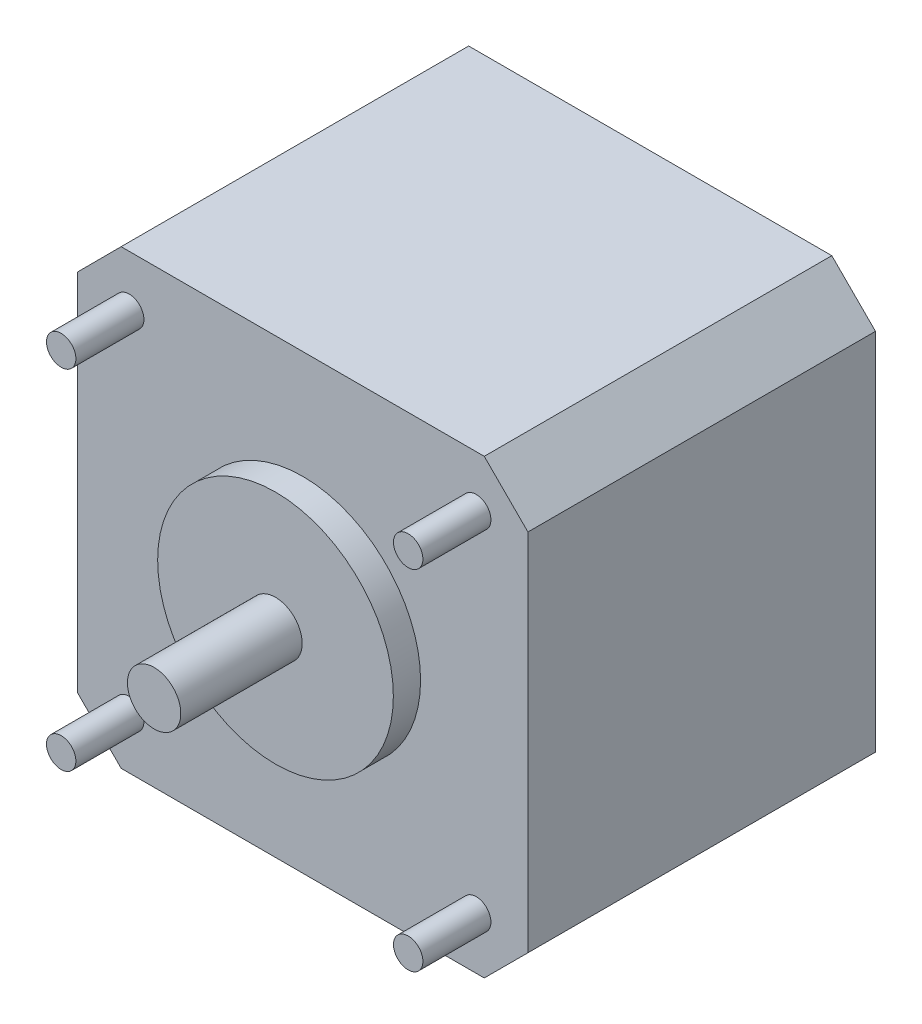
from build123d import *

# Parameters (mm, degrees)
BOSS_EXTRUDE4_DEPTH = 32.4358
SKETCH4_R           = 10.9982
BOSS_EXTRUDE5_DEPTH = 2.54
SKETCH5_R           = 2.4892
BOSS_EXTRUDE6_DEPTH = 11.3284
SKETCH6_R           = 1.3716
BOSS_EXTRUDE7_DEPTH = 6.35
BOSS_EXTRUDE8_START = 0.9144
SKETCH7_R           = 2.4892
BOSS_EXTRUDE8_DEPTH = 0.9144


with BuildPart() as part:
    # Sketch1 → Boss-Extrude4 (new body)
    with BuildSketch(Plane.XY):
        Polygon((0, 4.077036279), (4.077036279, 0), (37.959963721, 0), (42.037, 4.077036279), (42.037, 38.086963721), (37.959963721, 42.164), (4.070882272, 42.164), (0, 38.08081899), align=None)
    extrude(amount=BOSS_EXTRUDE4_DEPTH)

    # Sketch4 → Boss-Extrude5 (add)
    with BuildSketch(Plane.XY.offset(32.4358)):
        with Locations((21.0185, 21.078927634)):
            Circle(SKETCH4_R)
    extrude(amount=BOSS_EXTRUDE5_DEPTH)

    # Sketch5 → Boss-Extrude6 (add)
    with BuildSketch(Plane.XY.offset(34.9758)):
        with Locations(Location((21.0185, 21.078927634, 0), (0, 0, 180))):
            Circle(SKETCH5_R)
    extrude(amount=BOSS_EXTRUDE6_DEPTH)

    # Sketch6 → Boss-Extrude7 (add)
    with BuildSketch(Plane.XY.offset(32.4358)):
        with Locations((4.826, 37.338)):
            Circle(SKETCH6_R)
        with Locations((4.826, 4.826)):
            Circle(SKETCH6_R)
        with Locations((37.211, 4.826)):
            Circle(SKETCH6_R)
        with Locations((37.211, 37.338)):
            Circle(SKETCH6_R)
    extrude(amount=BOSS_EXTRUDE7_DEPTH)

    # Sketch7 → Boss-Extrude8 (add)
    with BuildSketch(Plane(origin=(0, 0, 0), x_dir=(-1, 0, 0), z_dir=(0, 0, -1)).offset(BOSS_EXTRUDE8_START)):
        with Locations((-21.0185, 21.078927634)):
            Circle(SKETCH7_R)
    extrude(amount=-BOSS_EXTRUDE8_DEPTH)


solid = part.part
